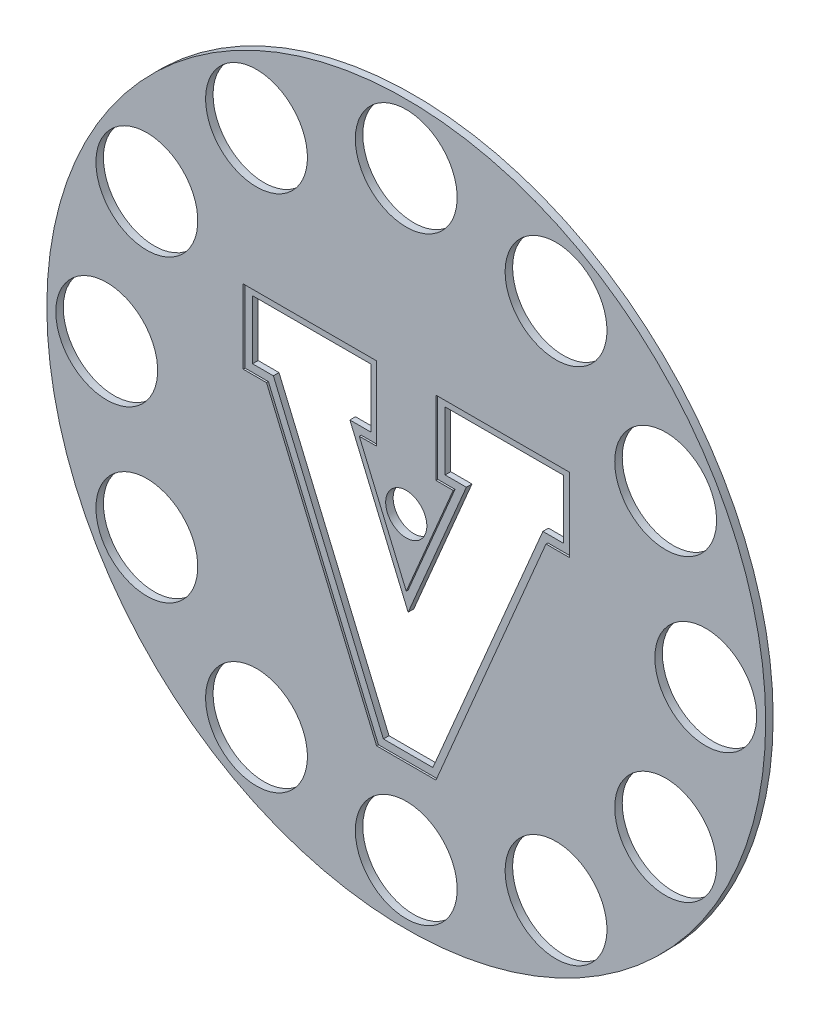
from build123d import *

# Parameters (mm, degrees)
SKETCH1_R               = 609.6
SKETCH1_R_2             = 86.36
SKETCH1_R_3             = 34.925
BOSS_EXTRUDE1_DEPTH     = 12.7
CUT_EXTRUDE1_DEPTH      = 863.198126883
CUT_EXTRUDE1_DEPTH_BACK = 3.175


with BuildPart() as part:
    # Sketch1 → Boss-Extrude1 (new body)
    with BuildSketch(Plane.XY):
        with Locations(Location((0, 0, 0), (0, 0, 180))):
            Circle(SKETCH1_R)
        with Locations(Location((0, 508, 0), (0, 0, 180))):
            Circle(SKETCH1_R_2, mode=Mode.SUBTRACT)
        with Locations(Location((254, 439.940905122, 0), (0, 0, 180))):
            Circle(SKETCH1_R_2, mode=Mode.SUBTRACT)
        with Locations(Location((439.940905123, 254, 0), (0, 0, 180))):
            Circle(SKETCH1_R_2, mode=Mode.SUBTRACT)
        with Locations(Location((508, 0, 0), (0, 0, 180))):
            Circle(SKETCH1_R_2, mode=Mode.SUBTRACT)
        with Locations(Location((439.940905123, -254, 0), (0, 0, 180))):
            Circle(SKETCH1_R_2, mode=Mode.SUBTRACT)
        with Locations(Location((254, -439.940905122, 0), (0, 0, 180))):
            Circle(SKETCH1_R_2, mode=Mode.SUBTRACT)
        with Locations(Location((0, -508, 0), (0, 0, 180))):
            Circle(SKETCH1_R_2, mode=Mode.SUBTRACT)
        with Locations(Location((-254, -439.940905123, 0), (0, 0, 180))):
            Circle(SKETCH1_R_2, mode=Mode.SUBTRACT)
        with Locations(Location((-439.940905122, -254, 0), (0, 0, 180))):
            Circle(SKETCH1_R_2, mode=Mode.SUBTRACT)
        with Locations(Location((-508, 0, 0), (0, 0, 180))):
            Circle(SKETCH1_R_2, mode=Mode.SUBTRACT)
        with Locations(Location((-439.940905122, 254, 0), (0, 0, 180))):
            Circle(SKETCH1_R_2, mode=Mode.SUBTRACT)
        with Locations(Location((-254, 439.940905122, 0), (0, 0, 180))):
            Circle(SKETCH1_R_2, mode=Mode.SUBTRACT)
        with Locations(Location((0, 0, 0), (0, 0, 180))):
            Circle(SKETCH1_R_3, mode=Mode.SUBTRACT)
        Polygon((-263.817141205, 187.315483827), (-62.758262665, 187.315483827), (-62.758262665, 87.367139582), (-98.786154196, 87.367139582), (0, -145.651965314), (98.786154196, 87.367139582), (62.758262665, 87.367139582), (62.758262665, 187.315483827), (263.817141205, 187.315483827), (263.817141205, 87.367139582), (228.547895375, 87.367139582), (41.969279032, -352.738890732), (-41.969279032, -352.738890732), (-228.547895375, 87.367139582), (-263.817141205, 87.367139582), align=None, mode=Mode.SUBTRACT)
    extrude(amount=BOSS_EXTRUDE1_DEPTH)

    # Sketch2 → Cut-Extrude1 (cut, two sides: drawn at the far end of the back side and taken through both)
    with BuildSketch(Plane.XY.offset(12.7).offset(-CUT_EXTRUDE1_DEPTH_BACK)):
        Polygon((50.058262665, 74.667139582), (79.607989254, 74.667139582), (0, -113.1140586), (-79.607989254, 74.667139582), (-50.058262665, 74.667139582), (-50.058262665, 200.015483827), (-276.517141205, 200.015483827), (-276.517141205, 74.667139582), (-236.957980515, 74.667139582), (-50.379364172, -365.438890732), (50.379364172, -365.438890732), (236.957980515, 74.667139582), (276.517141205, 74.667139582), (276.517141205, 200.015483827), (50.058262665, 200.015483827), align=None)
        Polygon((-41.969279032, -352.738890732), (-228.547895375, 87.367139582), (-263.817141205, 87.367139582), (-263.817141205, 187.315483827), (-62.758262665, 187.315483827), (-62.758262665, 87.367139582), (-98.786154196, 87.367139582), (0, -145.651965314), (98.786154196, 87.367139582), (62.758262665, 87.367139582), (62.758262665, 187.315483827), (263.817141205, 187.315483827), (263.817141205, 87.367139582), (228.547895375, 87.367139582), (41.969279032, -352.738890732), align=None, mode=Mode.SUBTRACT)
    extrude(amount=CUT_EXTRUDE1_DEPTH + CUT_EXTRUDE1_DEPTH_BACK, mode=Mode.SUBTRACT)


solid = part.part
